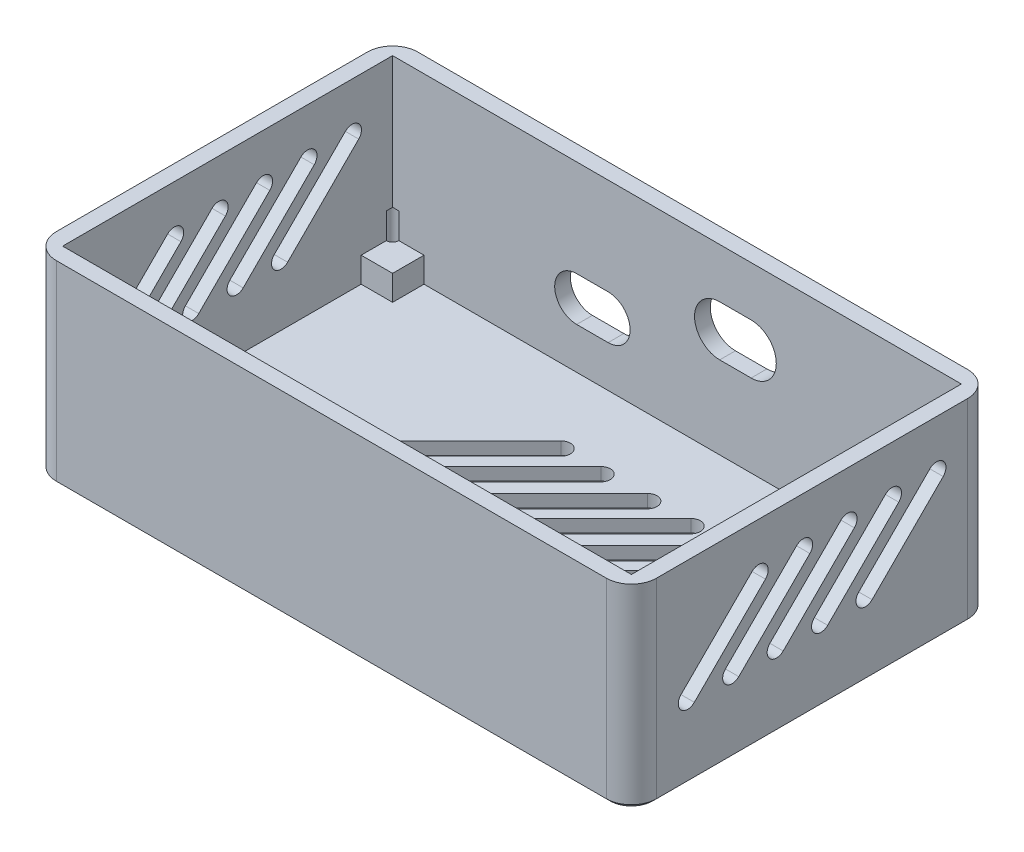
from build123d import *

# Parameters (mm, degrees)
CUERPO_DEPTH                  = 31
CROQUIS_HUECO_PCB_W           = 90.5
CROQUIS_HUECO_PCB_H           = 52.5
HUECO_PCB_DEPTH               = 29
CROQUIS_APOYOS_W              = 5
CROQUIS_APOYOS_H              = 5
APOYOS_PCB_DEPTH              = 4
CROQUIS_ALIVIOS_R             = 1
ALIVIOS_ESQUINAS_DEPTH        = 8.1
SALIDAS_USB_Y_PANEL_DEPTH     = 64.777935056
VENTILAS_LATERALES_DEPTH      = 64.777935056
VENTILAS_LATERALES_DEPTH_BACK = 64.777935056
REJILLA_PISO_DEPTH            = 2
CHAFLAN_BASE_SIZE             = 0.6


with BuildPart() as part:
    # Croquis_contorno → Cuerpo (new body)
    with BuildSketch(Plane(origin=(0, 0, 0), x_dir=(1, 0, 0), z_dir=(0, 1, 0))):
        with BuildLine():
            Line((-43.75, -28.75), (43.75, -28.75))
            ThreePointArc((43.75, -28.75), (46.578427125, -27.578427125), (47.75, -24.75))
            Line((47.75, -24.75), (47.75, 24.75))
            ThreePointArc((47.75, 24.75), (46.578427125, 27.578427125), (43.75, 28.75))
            Line((43.75, 28.75), (-43.75, 28.75))
            ThreePointArc((-43.75, 28.75), (-46.578427125, 27.578427125), (-47.75, 24.75))
            Line((-47.75, 24.75), (-47.75, -24.75))
            ThreePointArc((-47.75, -24.75), (-46.578427125, -27.578427125), (-43.75, -28.75))
        make_face()
    extrude(amount=CUERPO_DEPTH)

    # Croquis_hueco_PCB → Hueco_PCB (cut)
    with BuildSketch(Plane(origin=(0, 31, 0), x_dir=(1, 0, 0), z_dir=(0, 1, 0))):
        Rectangle(CROQUIS_HUECO_PCB_W, CROQUIS_HUECO_PCB_H)
    extrude(amount=-HUECO_PCB_DEPTH, mode=Mode.SUBTRACT)

    # Croquis_apoyos → Apoyos_PCB (add)
    with BuildSketch(Plane(origin=(0, 2, 0), x_dir=(1, 0, 0), z_dir=(0, 1, 0))):
        with Locations((-42.75, -23.75)):
            Rectangle(CROQUIS_APOYOS_W, CROQUIS_APOYOS_H)
        with Locations((-42.75, 23.75)):
            Rectangle(CROQUIS_APOYOS_W, CROQUIS_APOYOS_H)
        with Locations((42.75, -23.75)):
            Rectangle(CROQUIS_APOYOS_W, CROQUIS_APOYOS_H)
        with Locations((42.75, 23.75)):
            Rectangle(CROQUIS_APOYOS_W, CROQUIS_APOYOS_H)
    extrude(amount=APOYOS_PCB_DEPTH)

    # Croquis_alivios → Alivios_esquinas (cut)
    with BuildSketch(Plane(origin=(0, 2, 0), x_dir=(1, 0, 0), z_dir=(0, 1, 0))):
        with Locations(Location((-45.25, -26.25, 0), (0, 0, 90))):
            Circle(CROQUIS_ALIVIOS_R)
        with Locations(Location((-45.25, 26.25, 0), (0, 0, 270))):
            Circle(CROQUIS_ALIVIOS_R)
        with Locations(Location((45.25, -26.25, 0), (0, 0, 90))):
            Circle(CROQUIS_ALIVIOS_R)
        with Locations(Location((45.25, 26.25, 0), (0, 0, 270))):
            Circle(CROQUIS_ALIVIOS_R)
    extrude(amount=ALIVIOS_ESQUINAS_DEPTH, mode=Mode.SUBTRACT)

    # Croquis_salidas → Salidas_USB_y_panel (cut, through all)
    with BuildSketch(Plane.XY):
        with BuildLine():
            Line((6.8, 23.1), (11.8, 23.1))
            ThreePointArc((11.8, 23.1), (15.8, 19.1), (11.8, 15.1))
            Line((11.8, 15.1), (6.8, 15.1))
            ThreePointArc((6.8, 15.1), (2.8, 19.1), (6.8, 23.1))
        make_face()
        with BuildLine():
            Line((-15.96, 15.6), (-10.96, 15.6))
            ThreePointArc((-10.96, 15.6), (-7.46, 12.1), (-10.96, 8.6))
            Line((-10.96, 8.6), (-15.96, 8.6))
            ThreePointArc((-15.96, 8.6), (-19.46, 12.1), (-15.96, 15.6))
        make_face()
    extrude(amount=-SALIDAS_USB_Y_PANEL_DEPTH, mode=Mode.SUBTRACT)

    # Croquis_ventilas → Ventilas_laterales (cut, two sides: drawn at the far end of the back side and taken through both)
    with BuildSketch(Plane(origin=(0, 0, 0), x_dir=(0, 0, -1), z_dir=(1, 0, 0)).offset(-VENTILAS_LATERALES_DEPTH_BACK)):
        with BuildLine():
            Line((-20.859650045, 13.003805922), (-9.545941546, 24.317514421))
            ThreePointArc((-9.545941546, 24.317514421), (-7.424621202, 24.317514421), (-7.424621202, 22.196194078))
            Line((-7.424621202, 22.196194078), (-18.738329701, 10.882485579))
            ThreePointArc((-18.738329701, 10.882485579), (-20.859650045, 10.882485579), (-20.859650045, 13.003805922))
        make_face()
        with BuildLine():
            Line((-13.788582233, 13.003805922), (-2.474873734, 24.317514421))
            ThreePointArc((-2.474873734, 24.317514421), (-0.353553391, 24.317514421), (-0.353553391, 22.196194078))
            Line((-0.353553391, 22.196194078), (-11.66726189, 10.882485579))
            ThreePointArc((-11.66726189, 10.882485579), (-13.788582233, 10.882485579), (-13.788582233, 13.003805922))
        make_face()
        with BuildLine():
            Line((-6.717514421, 13.003805922), (4.596194078, 24.317514421))
            ThreePointArc((4.596194078, 24.317514421), (6.717514421, 24.317514421), (6.717514421, 22.196194078))
            Line((6.717514421, 22.196194078), (-4.596194078, 10.882485579))
            ThreePointArc((-4.596194078, 10.882485579), (-6.717514421, 10.882485579), (-6.717514421, 13.003805922))
        make_face()
        with BuildLine():
            Line((0.353553391, 13.003805922), (11.66726189, 24.317514421))
            ThreePointArc((11.66726189, 24.317514421), (13.788582233, 24.317514421), (13.788582233, 22.196194078))
            Line((13.788582233, 22.196194078), (2.474873734, 10.882485579))
            ThreePointArc((2.474873734, 10.882485579), (0.353553391, 10.882485579), (0.353553391, 13.003805922))
        make_face()
        with BuildLine():
            Line((7.424621202, 13.003805922), (18.738329701, 24.317514421))
            ThreePointArc((18.738329701, 24.317514421), (20.859650045, 24.317514421), (20.859650045, 22.196194078))
            Line((20.859650045, 22.196194078), (9.545941546, 10.882485579))
            ThreePointArc((9.545941546, 10.882485579), (7.424621202, 10.882485579), (7.424621202, 13.003805922))
        make_face()
    extrude(amount=VENTILAS_LATERALES_DEPTH + VENTILAS_LATERALES_DEPTH_BACK, mode=Mode.SUBTRACT)

    # Croquis_rejilla_piso → Rejilla_piso (cut)
    with BuildSketch(Plane(origin=(0, 0, 0), x_dir=(1, 0, 0), z_dir=(0, 1, 0))):
        with BuildLine():
            Line((-36.769552622, -13.435028843), (-7.778174593, 15.556349186))
            ThreePointArc((-7.778174593, 15.556349186), (-5.656854249, 15.556349186), (-5.656854249, 13.435028843))
            Line((-5.656854249, 13.435028843), (-34.648232278, -15.556349186))
            ThreePointArc((-34.648232278, -15.556349186), (-36.769552622, -15.556349186), (-36.769552622, -13.435028843))
        make_face()
        with BuildLine():
            Line((-29.69848481, -13.435028843), (-1.060660172, 15.202795796))
            ThreePointArc((-1.060660172, 15.202795796), (1.060660172, 15.202795796), (1.060660172, 13.081475452))
            Line((1.060660172, 13.081475452), (-27.577164466, -15.556349186))
            ThreePointArc((-27.577164466, -15.556349186), (-29.69848481, -15.556349186), (-29.69848481, -13.435028843))
        make_face()
        with BuildLine():
            Line((-22.273863607, -13.435028843), (6.363961031, 15.202795796))
            ThreePointArc((6.363961031, 15.202795796), (8.485281374, 15.202795796), (8.485281374, 13.081475452))
            Line((8.485281374, 13.081475452), (-20.152543264, -15.556349186))
            ThreePointArc((-20.152543264, -15.556349186), (-22.273863607, -15.556349186), (-22.273863607, -13.435028843))
        make_face()
        with BuildLine():
            Line((-15.379572491, -13.435028843), (13.258252147, 15.202795796))
            ThreePointArc((13.258252147, 15.202795796), (15.379572491, 15.202795796), (15.379572491, 13.081475452))
            Line((15.379572491, 13.081475452), (-13.258252147, -15.556349186))
            ThreePointArc((-13.258252147, -15.556349186), (-15.379572491, -15.556349186), (-15.379572491, -13.435028843))
        make_face()
        with BuildLine():
            Line((-7.954951288, -13.435028843), (20.68287335, 15.202795796))
            ThreePointArc((20.68287335, 15.202795796), (22.804193693, 15.202795796), (22.804193693, 13.081475452))
            Line((22.804193693, 13.081475452), (-5.833630945, -15.556349186))
            ThreePointArc((-5.833630945, -15.556349186), (-7.954951288, -15.556349186), (-7.954951288, -13.435028843))
        make_face()
        with BuildLine():
            Line((-1.060660172, -13.435028843), (27.577164466, 15.202795796))
            ThreePointArc((27.577164466, 15.202795796), (29.69848481, 15.202795796), (29.69848481, 13.081475452))
            Line((29.69848481, 13.081475452), (1.060660172, -15.556349186))
            ThreePointArc((1.060660172, -15.556349186), (-1.060660172, -15.556349186), (-1.060660172, -13.435028843))
        make_face()
        with BuildLine():
            Line((5.303300859, -13.435028843), (34.471455583, 15.733125881))
            ThreePointArc((34.471455583, 15.733125881), (36.592775926, 15.733125881), (36.592775926, 13.611805538))
            Line((36.592775926, 13.611805538), (7.424621202, -15.556349186))
            ThreePointArc((7.424621202, -15.556349186), (5.303300859, -15.556349186), (5.303300859, -13.435028843))
        make_face()
    extrude(amount=REJILLA_PISO_DEPTH, mode=Mode.SUBTRACT)

    # Chaflan_base
    chaflan_base_edges = [part.edges().sort_by_distance(p)[0] for p in [
        (47.75, 0, 0),
        (46.578427125, 0, 27.578427125),
        (0, 0, 28.75),
        (-46.578427125, 0, 27.578427125),
        (-47.75, 0, 0),
        (-46.578427125, 0, -27.578427125),
        (0, 0, -28.75),
        (46.578427125, 0, -27.578427125),
    ]]
    chamfer(chaflan_base_edges, length=CHAFLAN_BASE_SIZE)


solid = part.part
